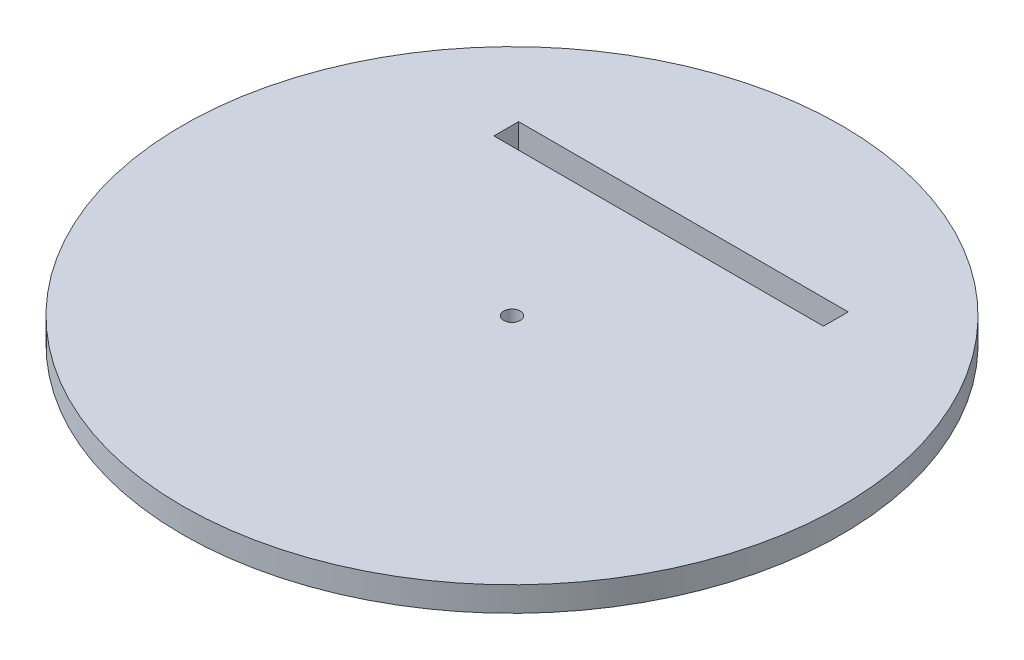
from build123d import *

# Parameters (mm, degrees)
SKETCH1_R           = 40
BOSS_EXTRUDE1_DEPTH = 3
SKETCH2_R           = 1
CUT_EXTRUDE1_DEPTH  = 3
SKETCH3_W           = 40
SKETCH3_H           = 3
CUT_EXTRUDE2_DEPTH  = 10


with BuildPart() as part:
    # Sketch1 → Boss-Extrude1 (new body)
    with BuildSketch(Plane(origin=(0, 0, 0), x_dir=(1, 0, 0), z_dir=(0, 1, 0))):
        with Locations(Location((0, 0, 0), (0, 0, 270))):
            Circle(SKETCH1_R)
    extrude(amount=BOSS_EXTRUDE1_DEPTH)

    # Sketch2 → Cut-Extrude1 (cut)
    with BuildSketch(Plane(origin=(0, 3, 0), x_dir=(1, 0, 0), z_dir=(0, 1, 0))):
        with Locations(Location((0, 0, 0), (0, 0, 270))):
            Circle(SKETCH2_R)
    extrude(amount=-CUT_EXTRUDE1_DEPTH, mode=Mode.SUBTRACT)

    # Sketch3 → Cut-Extrude2 (cut)
    with BuildSketch(Plane(origin=(0, 3, 0), x_dir=(1, 0, 0), z_dir=(0, 1, 0))):
        with Locations((0, 19.302837328)):
            Rectangle(SKETCH3_W, SKETCH3_H)
    extrude(amount=-CUT_EXTRUDE2_DEPTH, mode=Mode.SUBTRACT)


solid = part.part
